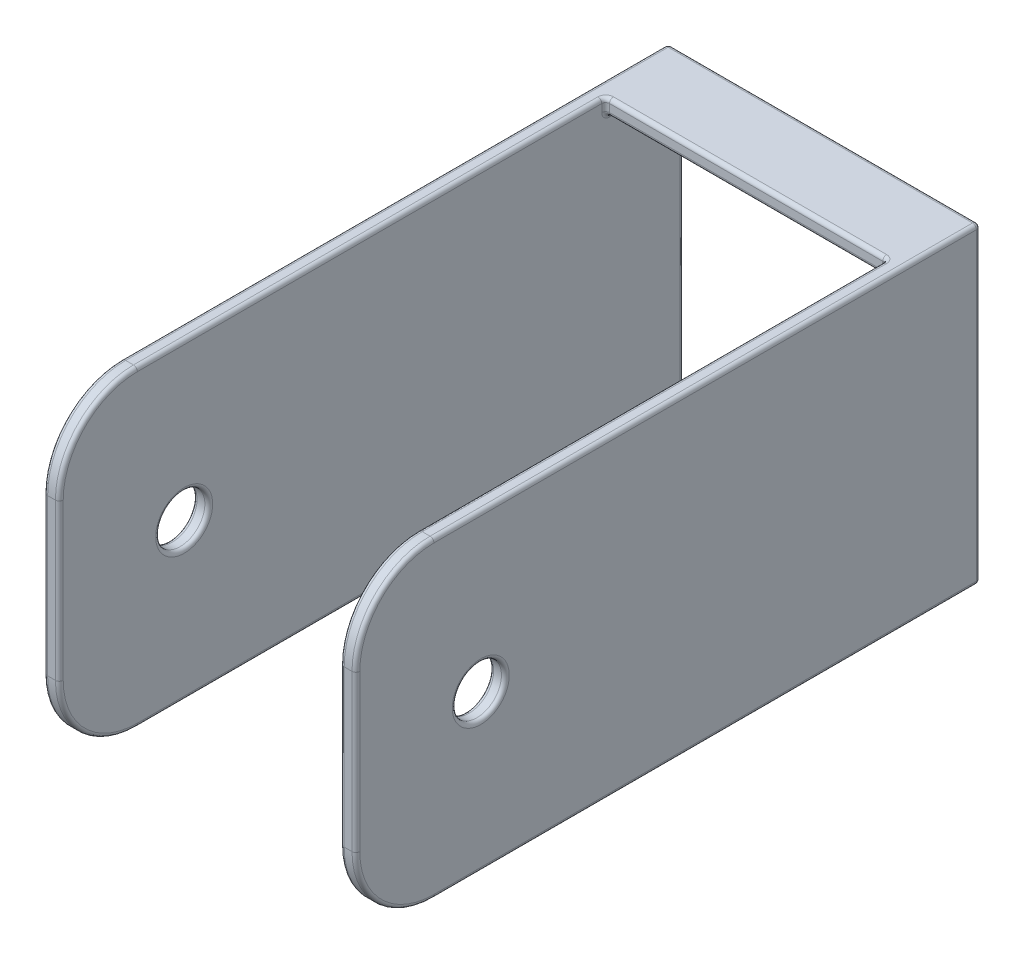
from build123d import *

# Parameters (mm, degrees)
SKIZZE1_W                       = 40
SKIZZE1_H                       = 40
SKIZZE1_W_2                     = 36
SKIZZE1_H_2                     = 36
AUFSATZ_LINEAR_AUSTRAGEN1_DEPTH = 80
SKIZZE2_W                       = 36
SKIZZE2_H                       = 70
SCHNITT_LINEAR_AUSTRAGEN1_DEPTH = 92.651513899
SKIZZE3_R                       = 3.15
SCHNITT_LINEAR_AUSTRAGEN2_DEPTH = 92.651513899
VERRUNDUNG1_R                   = 10
VERRUNDUNG2_R                   = 0.5


with BuildPart() as part:
    # Skizze1 → Aufsatz-Linear austragen1 (new body)
    with BuildSketch(Plane.XY):
        Rectangle(SKIZZE1_W, SKIZZE1_H)
        Rectangle(SKIZZE1_W_2, SKIZZE1_H_2, mode=Mode.SUBTRACT)
    extrude(amount=AUFSATZ_LINEAR_AUSTRAGEN1_DEPTH)

    # Skizze2 → Schnitt-Linear austragen1 (cut, through all)
    with BuildSketch(Plane(origin=(0, 20, 0), x_dir=(1, 0, 0), z_dir=(0, 1, 0))):
        with Locations((0, -45)):
            Rectangle(SKIZZE2_W, SKIZZE2_H)
    extrude(amount=-SCHNITT_LINEAR_AUSTRAGEN1_DEPTH, mode=Mode.SUBTRACT)

    # Skizze3 → Schnitt-Linear austragen2 (cut, through all)
    with BuildSketch(Plane(origin=(20, 0, 0), x_dir=(0, 0, -1), z_dir=(1, 0, 0))):
        with Locations((-64, 0)):
            Circle(SKIZZE3_R)
    extrude(amount=-SCHNITT_LINEAR_AUSTRAGEN2_DEPTH, mode=Mode.SUBTRACT)

    # Verrundung1
    verrundung1_edges = [part.edges().sort_by_distance(p)[0] for p in [
        (-19, -20, 80),
        (19, -20, 80),
        (-19, 20, 80),
        (19, 20, 80),
    ]]
    fillet(verrundung1_edges, radius=VERRUNDUNG1_R)

    # Verrundung2
    verrundung2_edges = [part.edges().sort_by_distance(p)[0] for p in [
        (18, 0, 0),
        (0, 18, 0),
        (-18, 0, 0),
        (0, -18, 0),
        (-18, -18, 5),
        (18, -18, 5),
        (0, -18, 10),
        (-18, 18, 5),
        (18, 18, 5),
        (0, 18, 10),
        (-18, 19, 10),
        (18, 19, 10),
        (-18, -20, 40),
        (0, -20, 10),
        (-18, -19, 10),
        (18, -19, 10),
        (-18, 20, 40),
        (0, 20, 10),
        (0, -20, 0),
        (-20, 0, 0),
        (0, 20, 0),
        (-18, 0, 67.15),
        (18, 0, 67.15),
        (-20, 0, 67.15),
        (20, 0, 67.15),
        (20, 0, 0),
        (-18, 0, 80),
        (-20, 0, 80),
        (-18, 17.071067812, 77.071067812),
        (-18, -17.071067812, 77.071067812),
        (-20, -20, 35),
        (20, -20, 35),
        (18, -20, 40),
        (-20, 20, 35),
        (-20, 17.071067812, 77.071067812),
        (-20, -17.071067812, 77.071067812),
        (18, 0, 80),
        (20, 0, 80),
        (20, 20, 35),
        (20, 17.071067812, 77.071067812),
        (20, -17.071067812, 77.071067812),
        (18, 20, 40),
        (18, 17.071067812, 77.071067812),
        (18, -17.071067812, 77.071067812),
    ]]
    fillet(verrundung2_edges, radius=VERRUNDUNG2_R)


solid = part.part
